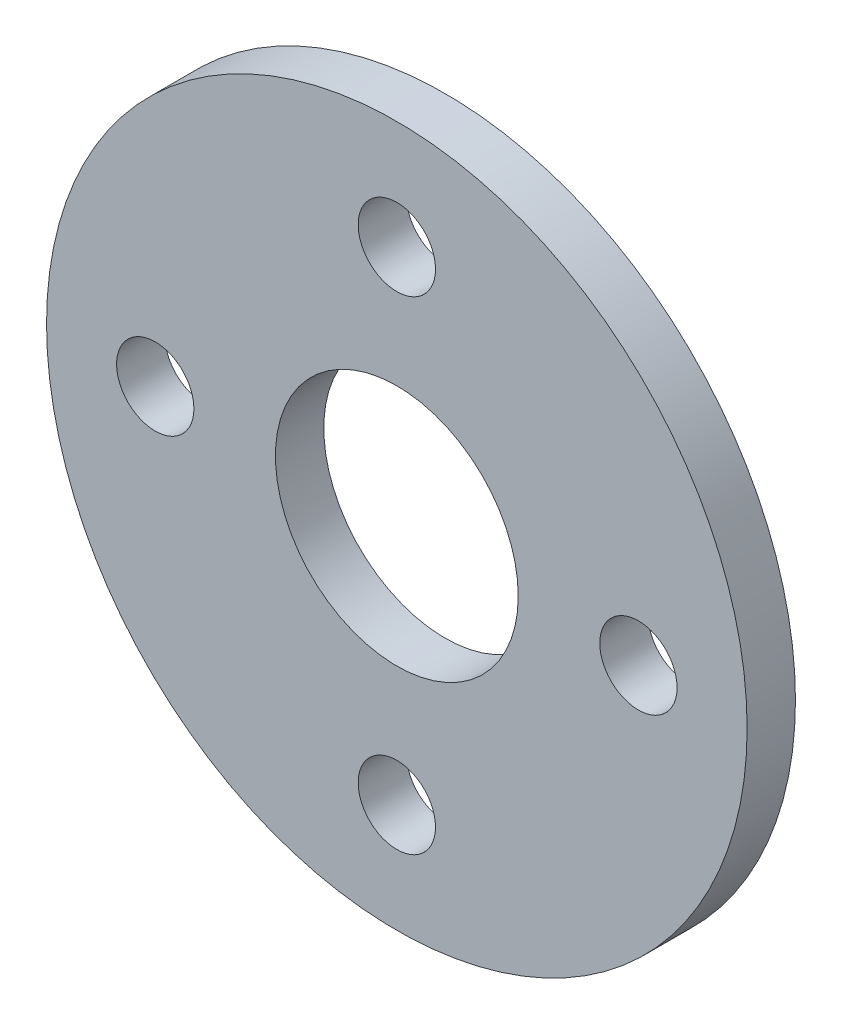
from build123d import *

# Parameters (mm, degrees)
SKETCH_1_R      = 14.5
SKETCH_1_R_2    = 1.6
SKETCH_1_R_3    = 5.025
EXTRUDE_1_DEPTH = 2


with BuildPart() as part:
    # ｽｹｯﾁ1 → ﾎﾞｽ - 押し出し1 (new body)
    with BuildSketch(Plane.XY):
        Circle(SKETCH_1_R)
        with Locations((0, 10)):
            Circle(SKETCH_1_R_2, mode=Mode.SUBTRACT)
        Circle(SKETCH_1_R_3, mode=Mode.SUBTRACT)
        with Locations((10, 0)):
            Circle(SKETCH_1_R_2, mode=Mode.SUBTRACT)
        with Locations((0, -10)):
            Circle(SKETCH_1_R_2, mode=Mode.SUBTRACT)
        with Locations((-10, 0)):
            Circle(SKETCH_1_R_2, mode=Mode.SUBTRACT)
    extrude(amount=EXTRUDE_1_DEPTH)


solid = part.part
